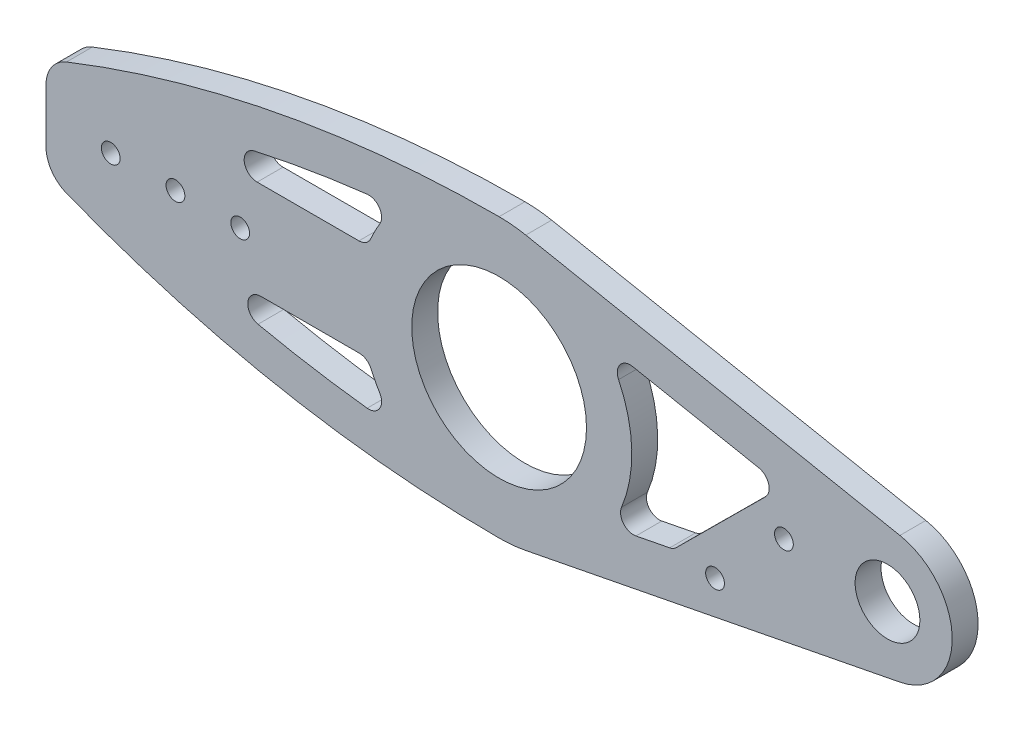
from build123d import *

# Parameters (mm, degrees)
SKETCH_1_R          = 13.5
SKETCH_1_R_2        = 5
EXTRUDE_1_DEPTH     = 4
SKETCH_2_R          = 1.45
CUT_EXTRUDE_1_DEPTH = 90.899944383
SKETCH_4_R          = 1.45
CUT_EXTRUDE_3_DEPTH = 90.899944383
FILLET_4_R          = 5
CUT_EXTRUDE_4_DEPTH = 90.899944383
FILLET_5_R          = 2


with BuildPart() as part:
    # 草图1 → 凸台-拉伸1 (new body)
    with BuildSketch(Plane.XY):
        with BuildLine():
            Line((-55, 0), (-55, -15))
            ThreePointArc((-55, -15), (-20.693136595, -25.465682976), (15, -29))
            ThreePointArc((15, -29), (17.07003357, -28.900115911), (19.120833333, -28.601391723))
            Line((19.120833333, -28.601391723), (76.916666667, -17.314600801))
            ThreePointArc((76.916666667, -17.314600801), (85, -7.5), (76.916666667, 2.314600801))
            Line((76.916666667, 2.314600801), (19.120833333, 13.601391723))
            ThreePointArc((19.120833333, 13.601391723), (17.07003357, 13.900115911), (15, 14))
            ThreePointArc((15, 14), (-20.693136595, 10.465682976), (-55, 0))
        make_face()
        with Locations((15, -7.5)):
            Circle(SKETCH_1_R, mode=Mode.SUBTRACT)
        with Locations((75, -7.5)):
            Circle(SKETCH_1_R_2, mode=Mode.SUBTRACT)
    extrude(amount=EXTRUDE_1_DEPTH)

    # 草图2 → 切除-拉伸1 (cut, through all)
    with BuildSketch(Plane.XY.offset(4)):
        with Locations((-45, -7.5)):
            Circle(SKETCH_2_R)
        with Locations((-35, -7.5)):
            Circle(SKETCH_2_R)
        with Locations((-25, -7.5)):
            Circle(SKETCH_2_R)
    extrude(amount=-CUT_EXTRUDE_1_DEPTH, mode=Mode.SUBTRACT)

    # 草图4 → 切除-拉伸3 (cut, through all)
    with BuildSketch(Plane(origin=(0, 0, 0), x_dir=(-1, 0, 0), z_dir=(0, 0, -1))):
        with Locations((-59, -7.117300414)):
            Circle(SKETCH_4_R)
        with Locations((-48.359904235, -17.69030198)):
            Circle(SKETCH_4_R)
    extrude(amount=-CUT_EXTRUDE_3_DEPTH, mode=Mode.SUBTRACT)

    # 圆角4
    fillet_4_edges = [part.edges().sort_by_distance(p)[0] for p in [
        (-55, -15, 2),
        (-55, 0, 2),
    ]]
    fillet(fillet_4_edges, radius=FILLET_4_R)

    # 草图5 → 切除-拉伸4 (cut, through all)
    with BuildSketch(Plane.XY.offset(4)):
        with BuildLine():
            Line((-37.662714363, -0.06358788), (-5.309418997, -0.06358788))
            ThreePointArc((-5.309418997, -0.06358788), (-3.415372639, 3.842256204), (-0.779510023, 7.291206463))
            ThreePointArc((-0.779510023, 7.291206463), (-19.418131409, 4.60183148), (-37.662714363, -0.06358788))
        make_face()
        with BuildLine():
            Line((-37.271815743, -15.058493623), (-5.264301107, -15.058493623))
            ThreePointArc((-5.264301107, -15.058493623), (-3.381161932, -18.897614279), (-0.779510023, -22.291206463))
            ThreePointArc((-0.779510023, -22.291206463), (-19.217302179, -19.641756918), (-37.271815743, -15.058493623))
        make_face()
        with BuildLine():
            Line((31.138502072, 5.141153068), (58.805420584, -0.261844115))
            Line((58.805420584, -0.261844115), (41.950078957, -17.010899515))
            Line((41.950078957, -17.010899515), (32.001874449, -18.953657286))
            ThreePointArc((32.001874449, -18.953657286), (35.486852137, -6.765909049), (31.138502072, 5.141153068))
        make_face()
    extrude(amount=-CUT_EXTRUDE_4_DEPTH, mode=Mode.SUBTRACT)

    # 圆角5
    fillet_5_edges = [part.edges().sort_by_distance(p)[0] for p in [
        (32.001874449, -18.953657286, 2),
        (31.138502072, 5.141153068, 2),
        (58.805420584, -0.261844115, 2),
        (41.950078957, -17.010899515, 2),
        (-37.662714363, -0.06358788, 2),
        (-0.779510023, 7.291206463, 2),
        (-5.309418997, -0.06358788, 2),
        (-0.779510023, -22.291206463, 2),
        (-37.271815743, -15.058493623, 2),
        (-5.264301107, -15.058493623, 2),
    ]]
    fillet(fillet_5_edges, radius=FILLET_5_R)


solid = part.part
